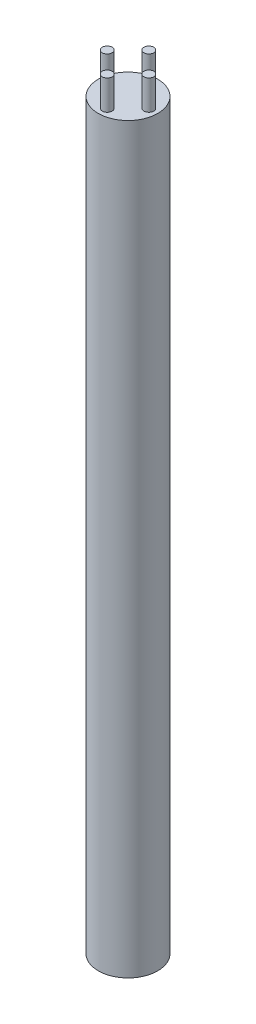
from build123d import *

# Parameters (mm, degrees)
SKETCH_1_W          = 10
SKETCH_1_H          = 300
SKETCH_2_R          = 1.65
EXTRUDE_1_DEPTH     = 10
SKETCH_3_R          = 10
CUT_EXTRUDE_1_DEPTH = 50


with BuildPart() as part:
    # 草图1 → 旋转1 (revolve)
    with BuildSketch(Plane.XY, mode=Mode.PRIVATE) as revolve_1_sk:
        with Locations((5, 150)):
            Rectangle(SKETCH_1_W, SKETCH_1_H)
    revolve(revolve_1_sk.sketch.rotate(Axis((0, 0, 0), (0, 1, 0)), 90), axis=Axis((0, 0, 0), (0, 1, 0)))

    # 草图2 → 凸台-拉伸1 (add)
    with BuildSketch(Plane(origin=(0, 300, 0), x_dir=(1, 0, 0), z_dir=(0, 1, 0))):
        with Locations(Location((7, 0, 0), (0, 0, 90))):
            Circle(SKETCH_2_R)
        with Locations(Location((0, -7, 0), (0, 0, 90))):
            Circle(SKETCH_2_R)
        with Locations(Location((-7, 0, 0), (0, 0, 90))):
            Circle(SKETCH_2_R)
        with Locations(Location((0, 7, 0), (0, 0, 90))):
            Circle(SKETCH_2_R)
    extrude(amount=EXTRUDE_1_DEPTH)

    # 草图3 → 切除-拉伸1 (cut)
    with BuildSketch(Plane.XZ):
        with Locations(Location((0, 0, 0), (0, 0, 270))):
            Circle(SKETCH_3_R)
    extrude(amount=-CUT_EXTRUDE_1_DEPTH, mode=Mode.SUBTRACT)


solid = part.part
